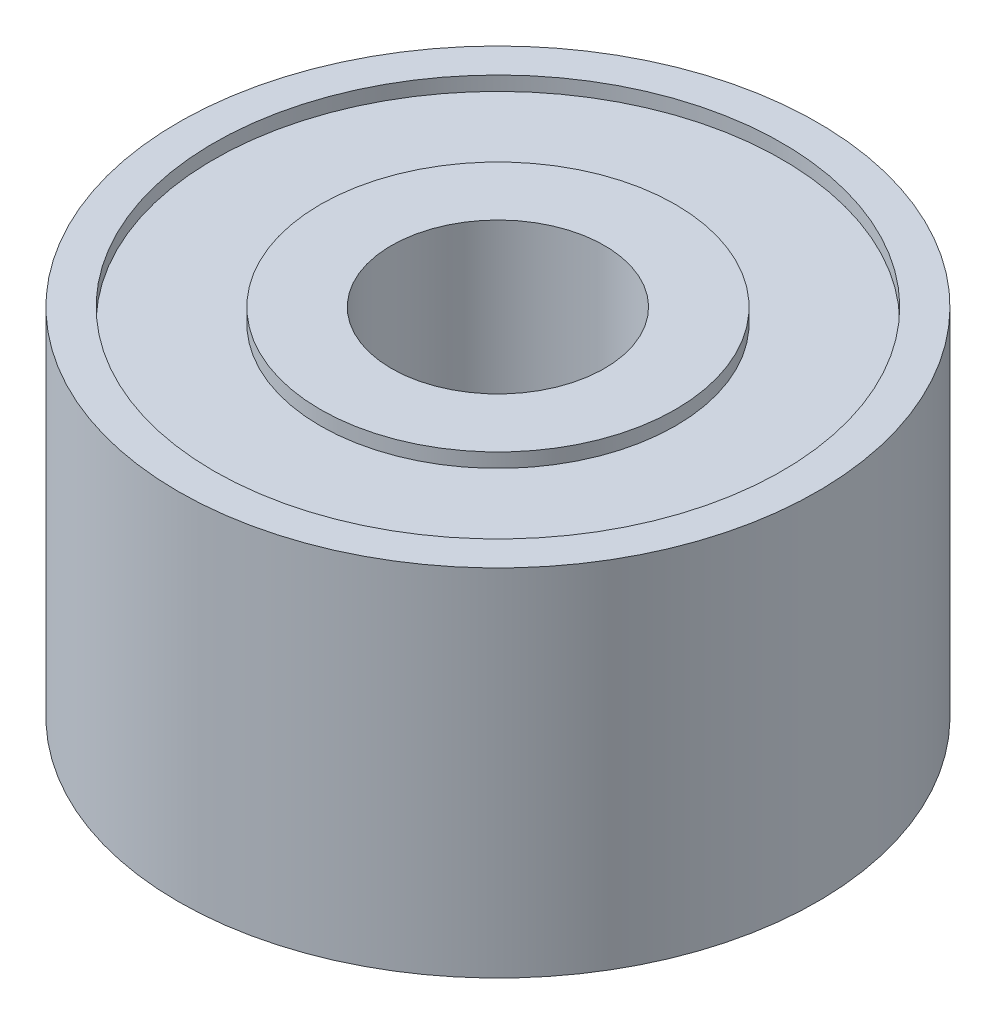
from build123d import *

# Parameters (mm, degrees)
SKETCH_1_R          = 4.5
SKETCH_1_R_2        = 1.5
EXTRUDE_1_DEPTH     = 5
SKETCH_2_R          = 4
SKETCH_2_R_2        = 2.5
CUT_EXTRUDE_1_DEPTH = 0.2
CUT_EXTRUDE_START   = -0.2
SKETCH_3_R          = 4
SKETCH_3_R_2        = 2.5
CUT_EXTRUDE_2_DEPTH = 0.2


with BuildPart() as part:
    # 草图1 → 凸台-拉伸1 (new body)
    with BuildSketch(Plane(origin=(0, 0, 0), x_dir=(1, 0, 0), z_dir=(0, 1, 0))):
        with Locations(Location((0, 0, 0), (0, 0, 270))):
            Circle(SKETCH_1_R)
        with Locations(Location((0, 0, 0), (0, 0, 270))):
            Circle(SKETCH_1_R_2, mode=Mode.SUBTRACT)
    extrude(amount=EXTRUDE_1_DEPTH)

    # 草图2 → 切除-拉伸1 (cut)
    with BuildSketch(Plane(origin=(0, 5, 0), x_dir=(1, 0, 0), z_dir=(0, 1, 0))):
        with Locations(Location((0, 0, 0), (0, 0, 270))):
            Circle(SKETCH_2_R)
        with Locations(Location((0, 0, 0), (0, 0, 270))):
            Circle(SKETCH_2_R_2, mode=Mode.SUBTRACT)
    extrude(amount=-CUT_EXTRUDE_1_DEPTH, mode=Mode.SUBTRACT)

    # 草图3 → 切除-拉伸2 (cut)
    with BuildSketch(Plane.XZ.offset(CUT_EXTRUDE_START)):
        with Locations(Location((0, 0, 0), (0, 0, 90))):
            Circle(SKETCH_3_R)
        with Locations(Location((0, 0, 0), (0, 0, 90))):
            Circle(SKETCH_3_R_2, mode=Mode.SUBTRACT)
    extrude(amount=CUT_EXTRUDE_2_DEPTH, mode=Mode.SUBTRACT)


solid = part.part
